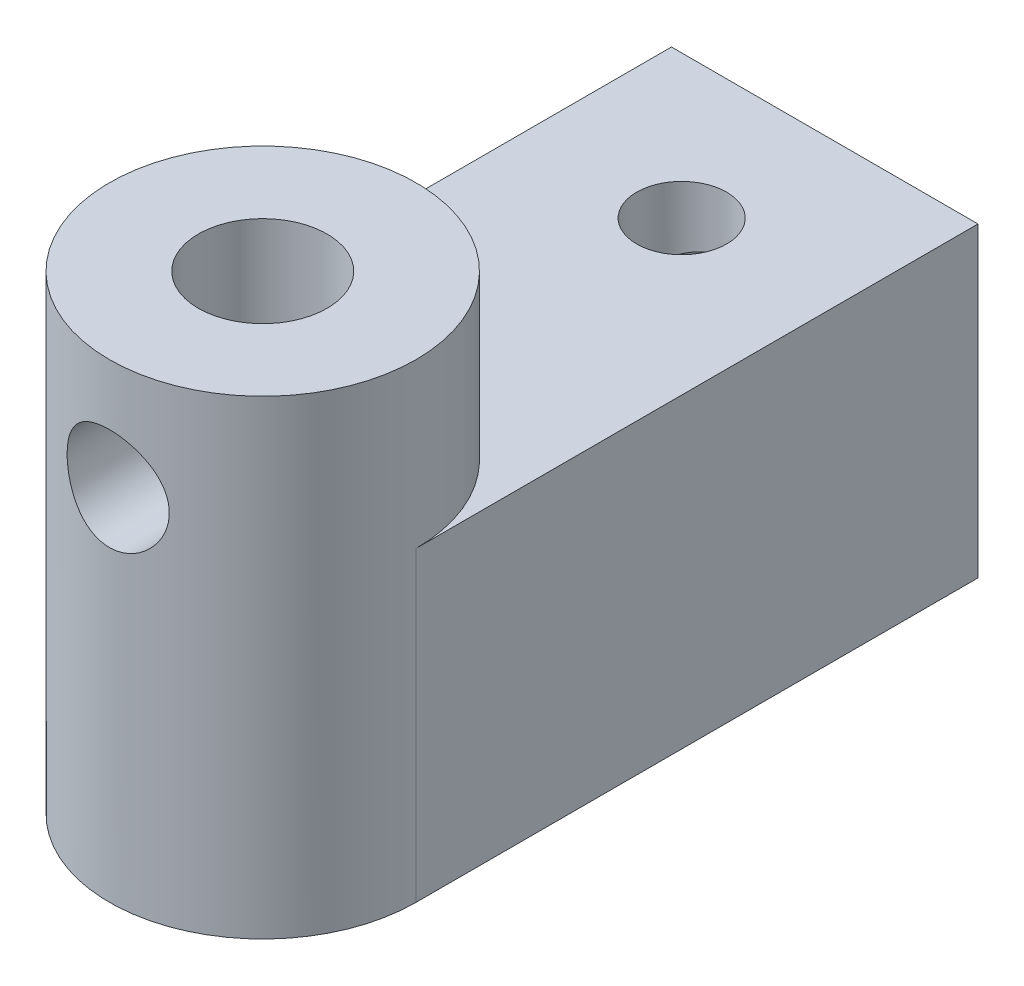
from build123d import *

# Parameters (mm, degrees)
SKETCH1_R                = 7.5
SKETCH1_R_2              = 3.15
BOSS_EXTRUDE1_DEPTH      = 13
BOSS_EXTRUDE2_START      = 10
SKETCH2_R                = 7.5
BOSS_EXTRUDE2_DEPTH      = 10
BOSS_EXTRUDE4_DEPTH      = 5
BOSS_EXTRUDE4_DEPTH_BACK = 10
SKETCH7_R                = 4.7
CUT_EXTRUDE2_DEPTH       = 20
SKETCH9_R                = 2.2
CUT_EXTRUDE4_DEPTH       = 37.626493144
CUT_EXTRUDE5_REACH       = 33.329
CUT_EXTRUDE5_END_RADIUS  = 7.5
SKETCH4_R                = 2.5


with BuildPart() as part:
    # Sketch1 → Boss-Extrude1 (new body)
    with BuildSketch(Plane(origin=(0, 0, 0), x_dir=(1, 0, 0), z_dir=(0, 1, 0))):
        with Locations(Location((0, 0, 0), (0, 0, 90))):
            Circle(SKETCH1_R)
        with Locations(Location((0, 0, 0), (0, 0, 90))):
            Circle(SKETCH1_R_2, mode=Mode.SUBTRACT)
    extrude(amount=BOSS_EXTRUDE1_DEPTH)

    # Sketch2 → Boss-Extrude2 (add)
    with BuildSketch(Plane.XZ.offset(BOSS_EXTRUDE2_START)):
        with Locations(Location((0, 0, 0), (0, 0, 270))):
            Circle(SKETCH2_R)
    extrude(amount=-BOSS_EXTRUDE2_DEPTH)

    # Sketch6 → Boss-Extrude4 (add, two sides: drawn at the far end of the back side and taken through both)
    with BuildSketch(Plane(origin=(0, 0, 0), x_dir=(1, 0, 0), z_dir=(0, 1, 0)).offset(-BOSS_EXTRUDE4_DEPTH_BACK)):
        with BuildLine():
            Line((-7.5, 0), (-7.5, 27.5))
            Line((-7.5, 27.5), (7.5, 27.5))
            Line((7.5, 27.5), (7.5, 0))
            ThreePointArc((7.5, 0), (0, 7.5), (-7.5, 0))
        make_face()
    extrude(amount=BOSS_EXTRUDE4_DEPTH + BOSS_EXTRUDE4_DEPTH_BACK)

    # Sketch7 → Cut-Extrude2 (cut)
    with BuildSketch(Plane(origin=(0, 0, -27.5), x_dir=(-1, 0, 0), z_dir=(0, 0, -1))):
        with Locations((0, -2.5)):
            Circle(SKETCH7_R)
    extrude(amount=-CUT_EXTRUDE2_DEPTH, mode=Mode.SUBTRACT)

    # Sketch9 → Cut-Extrude4 (cut, through all)
    with BuildSketch(Plane.XZ.offset(10)):
        with Locations(Location((0, -20.5, 0), (0, 0, 270))):
            Circle(SKETCH9_R)
    extrude(amount=-CUT_EXTRUDE4_DEPTH, mode=Mode.SUBTRACT)

    # Cut-Extrude5: up to this cylinder (the profile starts inside it)
    cut_extrude5_end = Plane(origin=(0, 7.53728, 0), z_dir=(0, -1, 0)) * Cylinder(CUT_EXTRUDE5_END_RADIUS, 82.658, mode=Mode.PRIVATE)
    # Sketch4 → Cut-Extrude5 (cut, up to the surface)
    with BuildSketch(Plane.XY, mode=Mode.PRIVATE) as cut_extrude5_sk1:
        with Locations(Location((0, 7.537279813, 0), (0, 0, 180))):
            Circle(SKETCH4_R)
    cut_extrude5_tool1 = extrude(cut_extrude5_sk1.sketch, amount=CUT_EXTRUDE5_REACH, mode=Mode.PRIVATE) & cut_extrude5_end
    add(cut_extrude5_tool1.solids().sort_by_distance((0, 7.53728, 0))[0], mode=Mode.SUBTRACT)


solid = part.part
